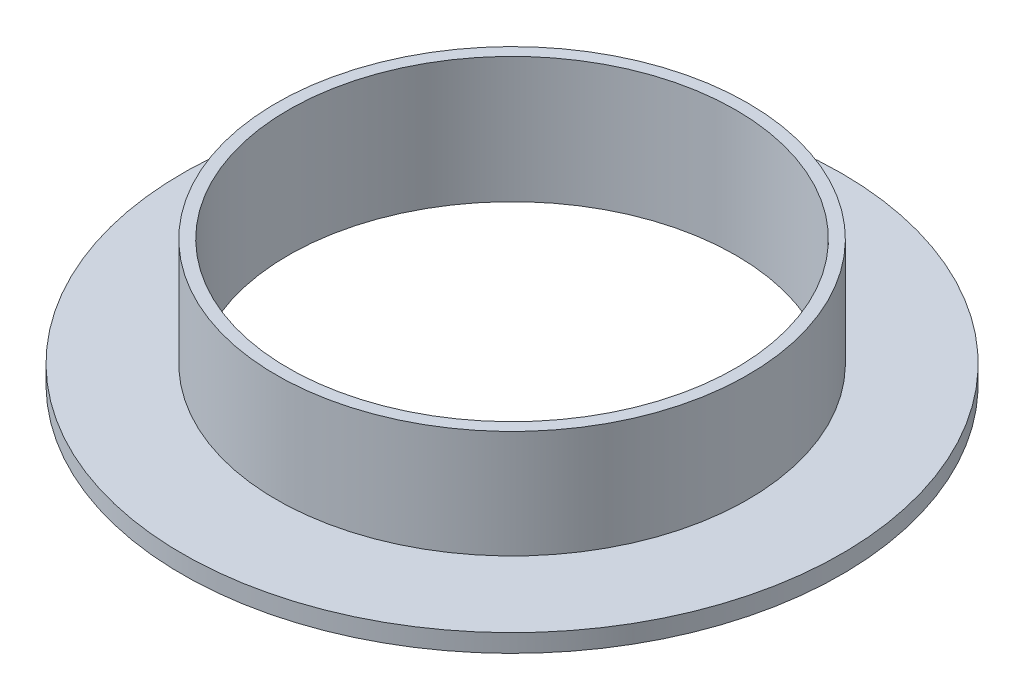
from build123d import *


with BuildPart() as part:
    # Esquisse1 → Révolution1 (revolve)
    with BuildSketch(Plane.XY, mode=Mode.PRIVATE) as r_volution1_sk:
        Polygon((-16.5, 0), (-11.2, 0), (-11.2, 6.3), (-11.8, 6.3), (-11.8, 0.9), (-16.5, 0.9), align=None)
    revolve(r_volution1_sk.sketch.rotate(Axis((0, 0, 0), (0, 1, 0)), 270), axis=Axis((0, 0, 0), (0, 1, 0)))


solid = part.part
